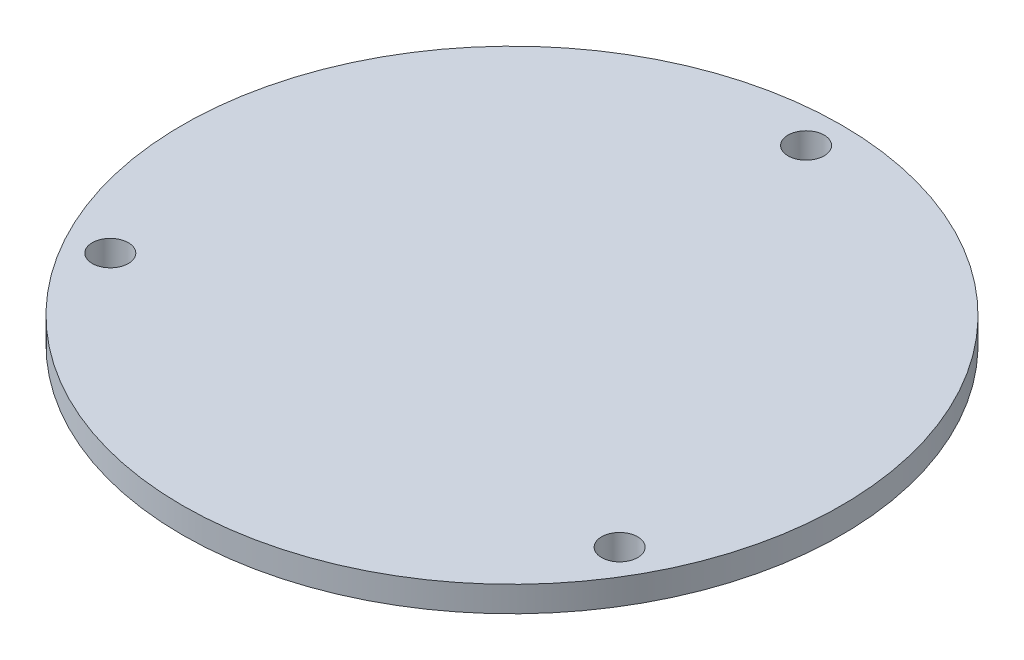
from build123d import *

# Parameters (mm, degrees)
SKETCH1_R               = 20.6375
BOSS_EXTRUDE1_DEPTH     = 1.6002
CUT_EXTRUDE1_DEPTH      = 30.229667335
CUT_EXTRUDE1_DEPTH_BACK = 30.229667335
SKETCH2_R               = 1.1303


with BuildPart() as part:
    # Sketch1 → Boss-Extrude1 (new body)
    with BuildSketch(Plane(origin=(0, 0, 0), x_dir=(1, 0, 0), z_dir=(0, 1, 0))):
        with Locations(Location((0, 0, 0), (0, 0, 270))):
            Circle(SKETCH1_R)
    extrude(amount=BOSS_EXTRUDE1_DEPTH)

    # Sketch2 → Cut-Extrude1 (cut, two sides: drawn at the far end of the back side and taken through both)
    with BuildSketch(Plane(origin=(0, 0, 0), x_dir=(1, 0, 0), z_dir=(0, 1, 0)).offset(-CUT_EXTRUDE1_DEPTH_BACK)):
        with Locations(Location((0, 18.415, 0), (0, 0, 270))):
            Circle(SKETCH2_R)
        with Locations(Location((15.947857811, -9.2075, 0), (0, 0, 270))):
            Circle(SKETCH2_R)
        with Locations(Location((-15.947857811, -9.2075, 0), (0, 0, 270))):
            Circle(SKETCH2_R)
    extrude(amount=CUT_EXTRUDE1_DEPTH + CUT_EXTRUDE1_DEPTH_BACK, mode=Mode.SUBTRACT)


solid = part.part
